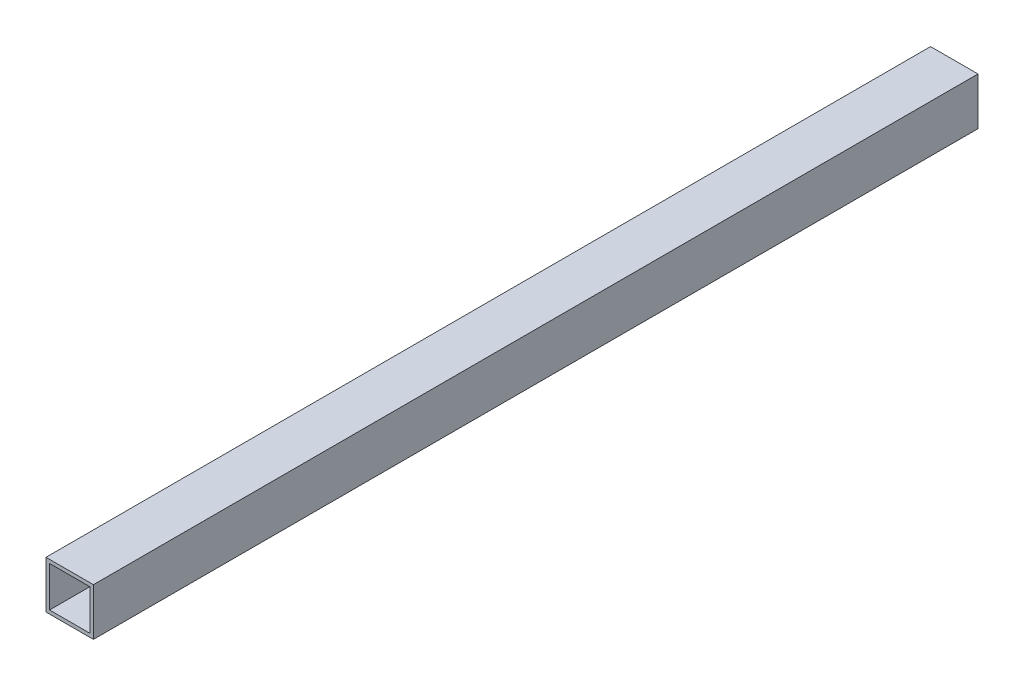
from build123d import *

# Parameters (mm, degrees)
SZKIC1_W                    = 20
SZKIC1_H                    = 20
SZKIC1_W_2                  = 17
SZKIC1_H_2                  = 17
DODANIE_WYCI_GNI_CIE1_DEPTH = 373


with BuildPart() as part:
    # Szkic1 → Dodanie-wyciągnięcie1 (new body)
    with BuildSketch(Plane.XY):
        Rectangle(SZKIC1_W, SZKIC1_H)
        Rectangle(SZKIC1_W_2, SZKIC1_H_2, mode=Mode.SUBTRACT)
    extrude(amount=DODANIE_WYCI_GNI_CIE1_DEPTH)


solid = part.part
